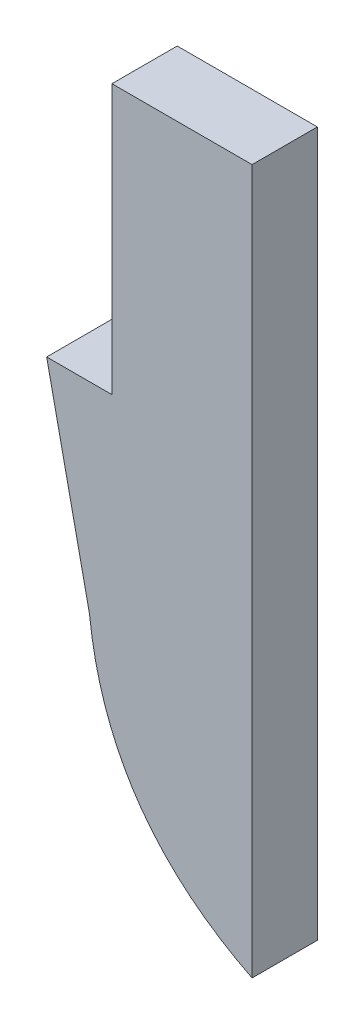
from build123d import *

# Parameters (mm, degrees)
EXTRUDE_1_DEPTH = 4


with BuildPart() as part:
    # Эскиз1 → Бобышка-Вытянуть1 (new body)
    with BuildSketch(Plane.XY):
        with BuildLine():
            Line((-82.424778316, -3.697860687), (-73.838144401, -3.697860687))
            Line((-73.838144401, -3.697860687), (-73.838144401, -46.859686904))
            add(Edge.make_bspline(
                [(-83.795378854, -32.554799456), (-82.720974338, -42.41019878), (-73.838144401, -46.859686904)],
                knots=[0, 0, 0, 1, 1, 1], degree=2))
            Line((-83.795378854, -32.554799456), (-86.424778316, -20.197860687))
            Line((-86.424778316, -20.197860687), (-82.424778316, -20.197860687))
            Line((-82.424778316, -20.197860687), (-82.424778316, -3.697860687))
        make_face()
    extrude(amount=EXTRUDE_1_DEPTH)


solid = part.part
